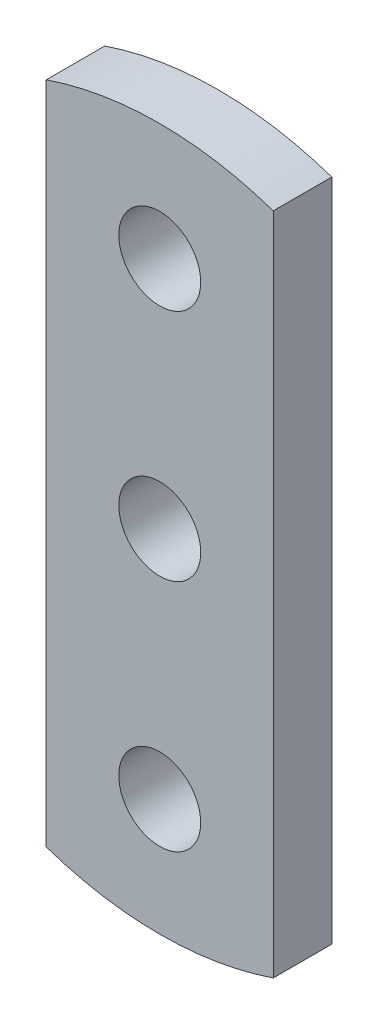
from build123d import *

# Parameters (mm, degrees)
CROQUIS1_R              = 1.75
SALIENTE_EXTRUIR1_DEPTH = 2.5


with BuildPart() as part:
    # Croquis1 → Saliente-Extruir1 (new body)
    with BuildSketch(Plane.XY):
        with BuildLine():
            Line((-4.85, 14.194277016), (-4.85, -14.194277016))
            ThreePointArc((-4.85, -14.194277016), (0, -15), (4.85, -14.194277016))
            Line((4.85, -14.194277016), (4.85, 14.194277016))
            ThreePointArc((4.85, 14.194277016), (0, 15), (-4.85, 14.194277016))
        make_face()
        with Locations((0, 10)):
            Circle(CROQUIS1_R, mode=Mode.SUBTRACT)
        with Locations((0, -10)):
            Circle(CROQUIS1_R, mode=Mode.SUBTRACT)
        Circle(CROQUIS1_R, mode=Mode.SUBTRACT)
    extrude(amount=SALIENTE_EXTRUIR1_DEPTH)


solid = part.part
